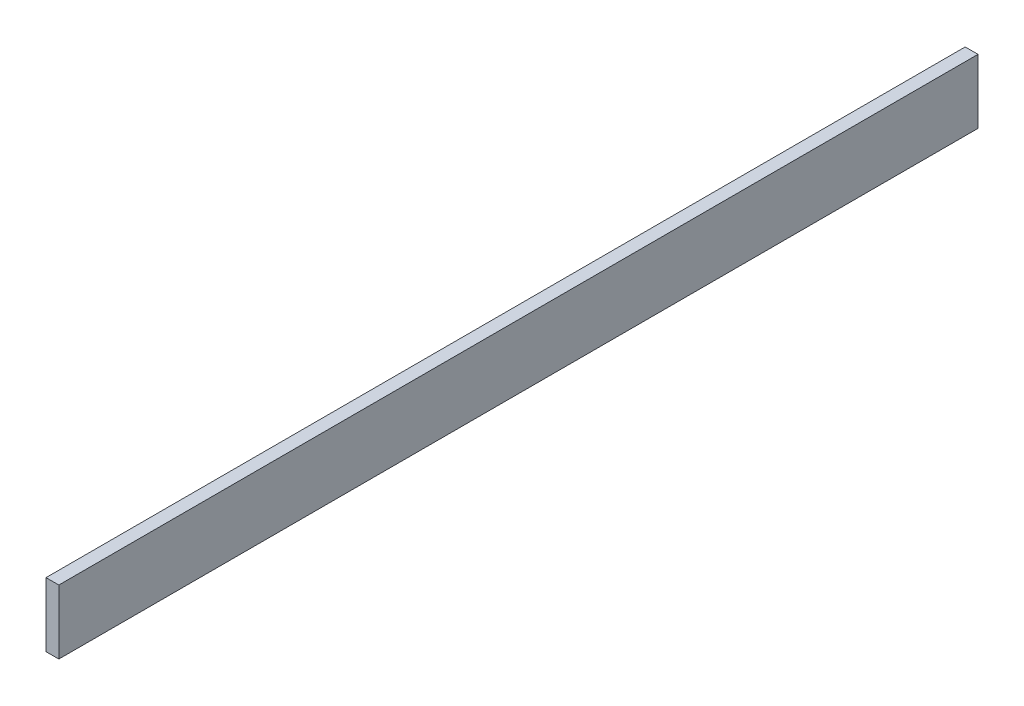
from build123d import *

# Parameters (mm, degrees)
SKETCH1_W           = 215
SKETCH1_H           = 15
BOSS_EXTRUDE1_DEPTH = 3


with BuildPart() as part:
    # Sketch1 → Boss-Extrude1 (new body)
    with BuildSketch(Plane(origin=(0, 0, 0), x_dir=(0, 0, -1), z_dir=(1, 0, 0))):
        Rectangle(SKETCH1_W, SKETCH1_H)
    extrude(amount=BOSS_EXTRUDE1_DEPTH)


solid = part.part
